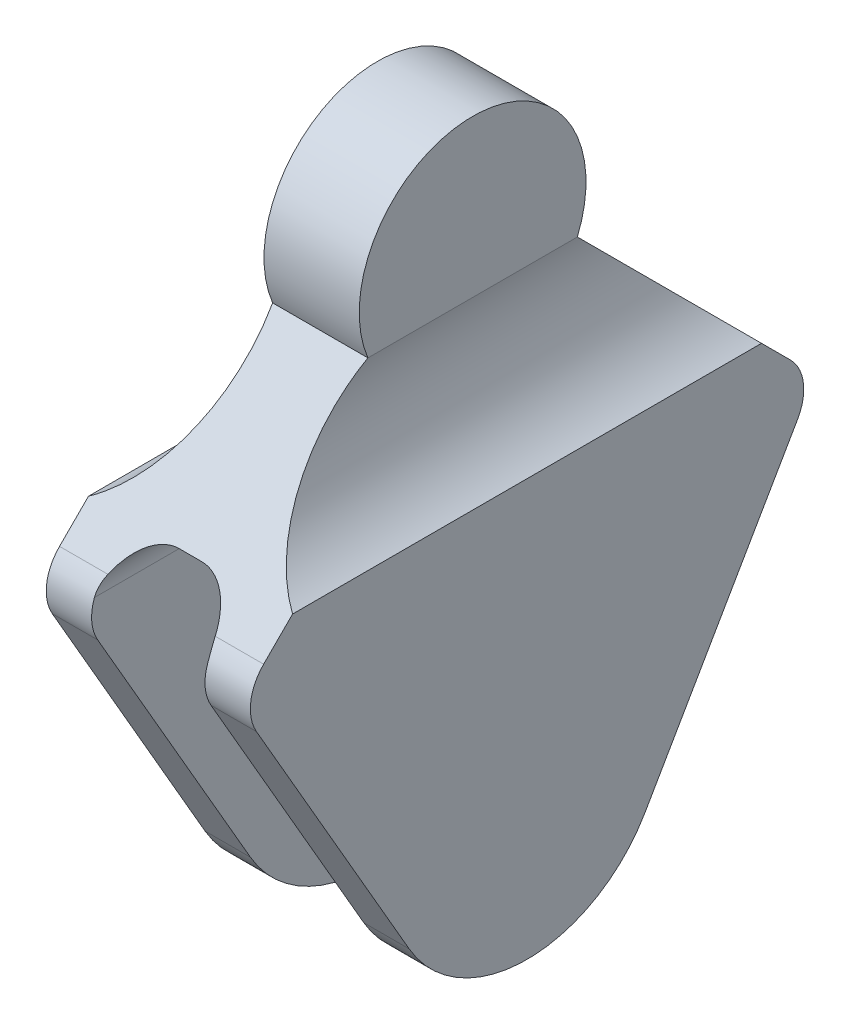
from build123d import *

# Parameters (mm, degrees)
BOSS_EXTRUDE2_DEPTH     = 45
CUT_EXTRUDE2_DEPTH      = 12
CUT_EXTRUDE4_START      = -33
CUT_EXTRUDE4_DEPTH      = 12
CUT_EXTRUDE5_DEPTH      = 182.957313627
CUT_EXTRUDE7_DEPTH      = 182.957313627
CUT_EXTRUDE7_DEPTH_BACK = 182.957313627


with BuildPart() as part:
    # Sketch1 → Boss-Extrude2 (new body)
    with BuildSketch(Plane(origin=(0, 0, 0), x_dir=(0, 0, -1), z_dir=(1, 0, 0))):
        with BuildLine():
            Line((-59.671894671, -56.645246646), (-25.980762114, -115))
            ThreePointArc((-25.980762114, -115), (0, -130), (25.980762114, -115))
            Line((25.980762114, -115), (59.671894671, -56.645246646))
            ThreePointArc((59.671894671, -56.645246646), (60.926089247, -50.339984724), (58.082708445, -44.574178834))
            Line((58.082708445, -44.574178834), (51.508529611, -38))
            Line((51.508529611, -38), (-51.508529611, -38))
            Line((-51.508529611, -38), (-58.082708445, -44.574178834))
            ThreePointArc((-58.082708445, -44.574178834), (-60.926089247, -50.339984724), (-59.671894671, -56.645246646))
        make_face()
        with BuildLine():
            Line((-23.090724242, -9.582194632), (-51.508529611, -38))
            Line((-51.508529611, -38), (51.508529611, -38))
            Line((51.508529611, -38), (23.090724242, -9.582194632))
            ThreePointArc((23.090724242, -9.582194632), (0, 25), (-23.090724242, -9.582194632))
        make_face()
    extrude(amount=-BOSS_EXTRUDE2_DEPTH)

    # Sketch3 → Cut-Extrude2 (cut)
    with BuildSketch(Plane(origin=(0, 0, 0), x_dir=(0, 0, -1), z_dir=(1, 0, 0))):
        with BuildLine():
            Line((-23.090724242, -9.582194632), (23.090724242, -9.582194632))
            ThreePointArc((23.090724242, -9.582194632), (0, 25), (-23.090724242, -9.582194632))
        make_face()
    extrude(amount=-CUT_EXTRUDE2_DEPTH, mode=Mode.SUBTRACT)

    # Sketch4 → Cut-Extrude4 (cut)
    with BuildSketch(Plane(origin=(0, 0, 0), x_dir=(0, 0, -1), z_dir=(1, 0, 0)).offset(CUT_EXTRUDE4_START)):
        with BuildLine():
            Line((-23.090724242, -9.582194632), (23.090724242, -9.582194632))
            ThreePointArc((23.090724242, -9.582194632), (0, 25), (-23.090724242, -9.582194632))
        make_face()
    extrude(amount=-CUT_EXTRUDE4_DEPTH, mode=Mode.SUBTRACT)

    # Sketch11 → Cut-Extrude5 (cut, through all)
    with BuildSketch(Plane.XY.offset(58.082708445)):
        with BuildLine():
            Line((-12, -9.582194632), (0, -9.582194632))
            Line((0, -9.582194632), (0, -38.192729996))
            ThreePointArc((0, -38.192729996), (-10.975035155, -25.97412099), (-12, -9.582194632))
        make_face()
        with BuildLine():
            Line((-45, -9.582194632), (-33, -9.582194632))
            ThreePointArc((-33, -9.582194632), (-34.024964845, -25.97412099), (-45, -38.192729996))
            Line((-45, -38.192729996), (-45, -9.582194632))
        make_face()
    extrude(amount=-CUT_EXTRUDE5_DEPTH, mode=Mode.SUBTRACT)

    # Sketch12 → Cut-Extrude7 (cut, two sides: drawn at the far end of the back side and taken through both)
    with BuildSketch(Plane.XY.offset(58.082708445).offset(-CUT_EXTRUDE7_DEPTH_BACK)):
        with BuildLine():
            Line((-35, -130.192729996), (-10, -130.192729996))
            Line((-10, -130.192729996), (-10, -48.192729996))
            ThreePointArc((-10, -48.192729996), (-12.928932188, -41.121662184), (-20, -38.192729996))
            Line((-20, -38.192729996), (-25, -38.192729996))
            ThreePointArc((-25, -38.192729996), (-32.071067812, -41.121662184), (-35, -48.192729996))
            Line((-35, -48.192729996), (-35, -130.192729996))
        make_face()
    extrude(amount=CUT_EXTRUDE7_DEPTH + CUT_EXTRUDE7_DEPTH_BACK, mode=Mode.SUBTRACT)


solid = part.part
